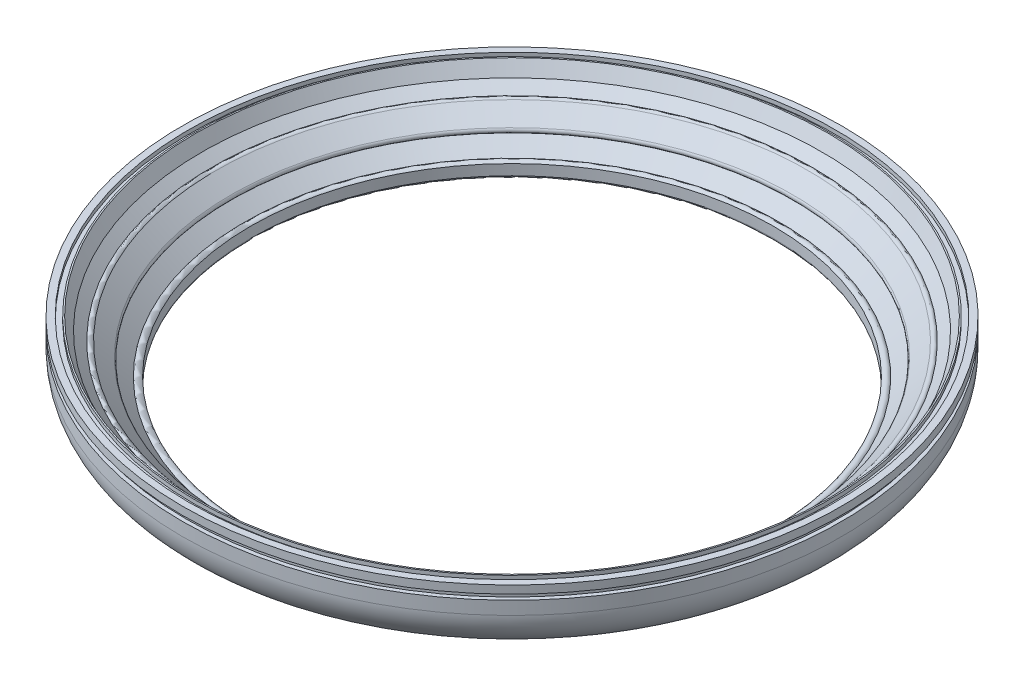
from build123d import *

# Parameters (mm, degrees)
FILLET1_R = 3
FILLET2_R = 0.2


with BuildPart() as part:
    # Sketch1 → Revolve1 (revolve)
    with BuildSketch(Plane.XY, mode=Mode.PRIVATE) as revolve1_sk:
        with BuildLine():
            Line((-25, 0), (-25, 4))
            Line((-25, 4), (-24.7, 4))
            Line((-24.7, 4), (-24.7, 4.4))
            Line((-24.7, 4.4), (-25, 4.4))
            Line((-25, 4.4), (-25, 5))
            Line((-25, 5), (-24.50212285, 5))
            Line((-24.50212285, 5), (-24.50212285, 4.7))
            Line((-24.50212285, 4.7), (-24.103052157, 4.7))
            Line((-24.103052157, 4.7), (-24.103052157, 5))
            Line((-24.103052157, 5), (-23.998622443, 5))
            Line((-23.998622443, 5), (-23.524722676, 4.007317266))
            Line((-23.524722676, 4.007317266), (-22.813203203, 3.341048672))
            ThreePointArc((-22.813203203, 3.341048672), (-22.63086099, 3.41657729), (-22.448518777, 3.341048672))
            Line((-22.448518777, 3.341048672), (-21.327008417, 2.290863599))
            ThreePointArc((-21.327008417, 2.290863599), (-21.256283233, 2.120117899), (-21.327008417, 1.9493722))
            Line((-21.327008417, 1.9493722), (-20.313000714, 0.999852879))
            ThreePointArc((-20.313000714, 0.999852879), (-20.065271662, 1.107306717), (-19.817478847, 1))
            Line((-19.817478847, 1), (-19.817478847, 0))
            Line((-19.817478847, 0), (-25, 0))
        make_face()
    revolve(revolve1_sk.sketch.rotate(Axis((0, 2.809033385, 0), (0, -1, 0)), 270), axis=Axis((0, 2.809033385, 0), (0, -1, 0)))

    # Fillet1
    fillet1_edges = [part.edges().sort_by_distance(p)[0] for p in [
        (0, 0, -25),
    ]]
    fillet(fillet1_edges, radius=FILLET1_R)

    # Fillet2
    fillet2_edges = [part.edges().sort_by_distance(p)[0] for p in [
        (0, 0, -19.817478847),
    ]]
    fillet(fillet2_edges, radius=FILLET2_R)


solid = part.part
